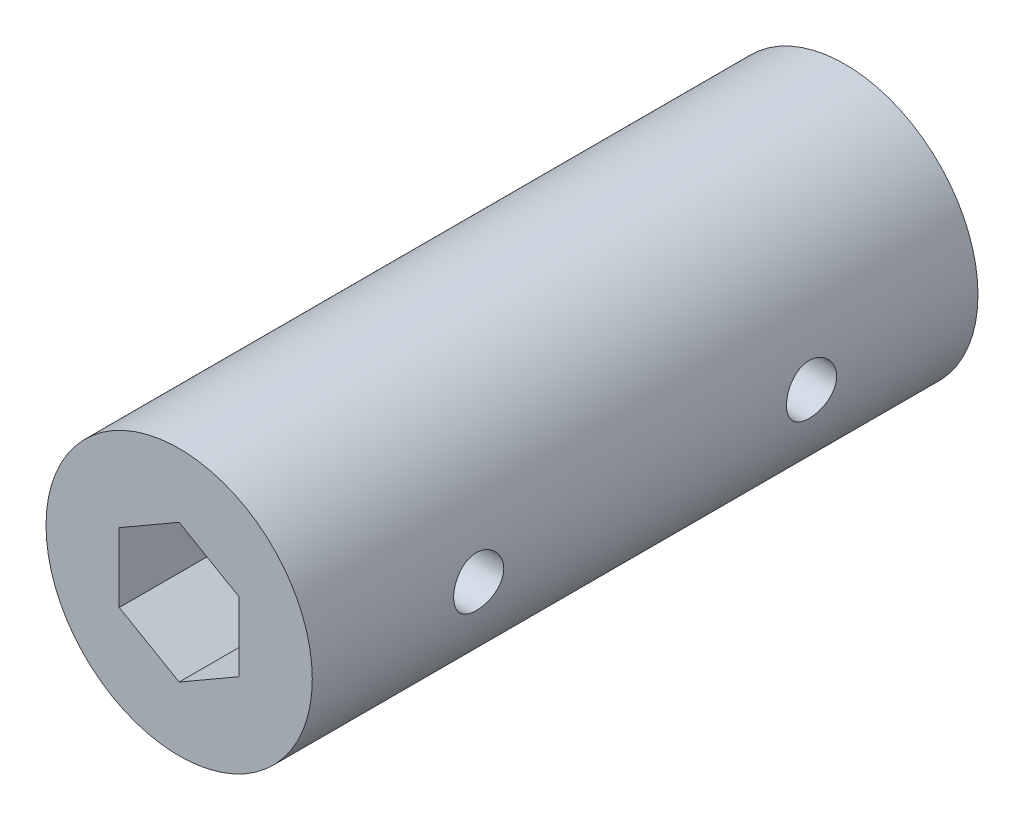
from build123d import *

# Parameters (mm, degrees)
MOTORSKE_R      = 2
MOTOR_DEPTH     = 5
AXISSKE_R       = 2
AXIS_DEPTH      = 5
SCREWHOLESKE_R  = 0.376260287
SCREWHOLE_DEPTH = 11.392304845


with BuildPart() as part:
    # MotorSke → Motor (new body)
    with BuildSketch(Plane.XY):
        Circle(MOTORSKE_R)
        with BuildLine():
            Line((1, 1.05), (1, -1.05))
            ThreePointArc((1, -1.05), (-1.45, 0), (1, 1.05))
        make_face(mode=Mode.SUBTRACT)
    extrude(amount=MOTOR_DEPTH)

    # AxisSke → Axis (add)
    with BuildSketch(Plane.XY.offset(5)):
        Circle(AXISSKE_R)
        Polygon((0, -1.039230485), (0.9, -0.519615242), (0.9, 0.519615242), (0, 1.039230485), (-0.9, 0.519615242), (-0.9, -0.519615242), align=None, mode=Mode.SUBTRACT)
    extrude(amount=AXIS_DEPTH)

    # ScrewHoleSke → ScrewHole (cut, through all)
    with BuildSketch(Plane(origin=(0, 0, 0), x_dir=(0, 0, -1), z_dir=(1, 0, 0))):
        with Locations(Location((-7.5, 0, 0), (0, 0, 180))):
            Circle(SCREWHOLESKE_R)
        with Locations(Location((-2.5, 0, 0), (0, 0, 180))):
            Circle(SCREWHOLESKE_R)
    extrude(amount=SCREWHOLE_DEPTH, mode=Mode.SUBTRACT)


solid = part.part
